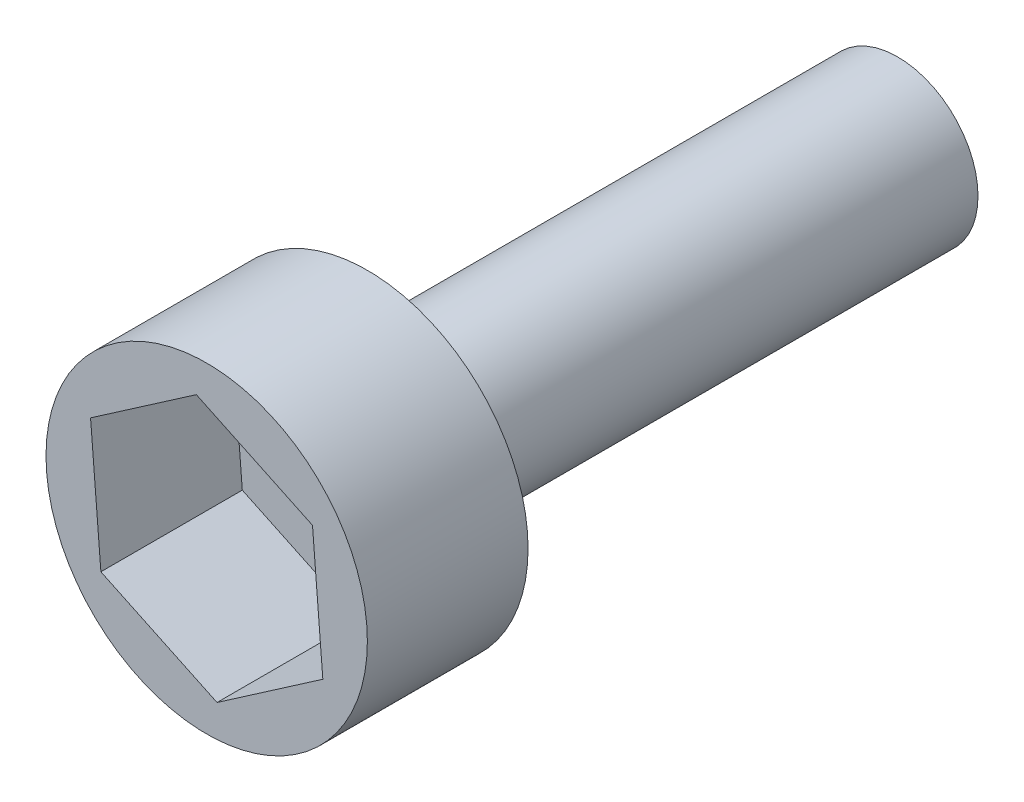
from build123d import *

# Parameters (mm, degrees)
CROQUIS1_R              = 1.5875
SALIENTE_EXTRUIR1_DEPTH = 10.4775
CROQUIS2_R              = 3.175
SALIENTE_EXTRUIR2_DEPTH = 3.175
CORTAR_EXTRUIR5_DEPTH   = 2.794


with BuildPart() as part:
    # Croquis1 → Saliente-Extruir1 (new body)
    with BuildSketch(Plane.XY):
        Circle(CROQUIS1_R)
    extrude(amount=-SALIENTE_EXTRUIR1_DEPTH)

    # Croquis2 → Saliente-Extruir2 (add)
    with BuildSketch(Plane.XY):
        Circle(CROQUIS2_R)
    extrude(amount=SALIENTE_EXTRUIR2_DEPTH)

    # Croquis3 → Cortar-Extruir5 (cut)
    with BuildSketch(Plane.XY.offset(3.175)):
        Polygon((2.294680271, -1.089055764), (2.090490093, 1.442723526), (-0.204190178, 2.53177929), (-2.294680271, 1.089055764), (-2.090490093, -1.442723526), (0.204190178, -2.53177929), align=None)
    extrude(amount=-CORTAR_EXTRUIR5_DEPTH, mode=Mode.SUBTRACT)


solid = part.part
